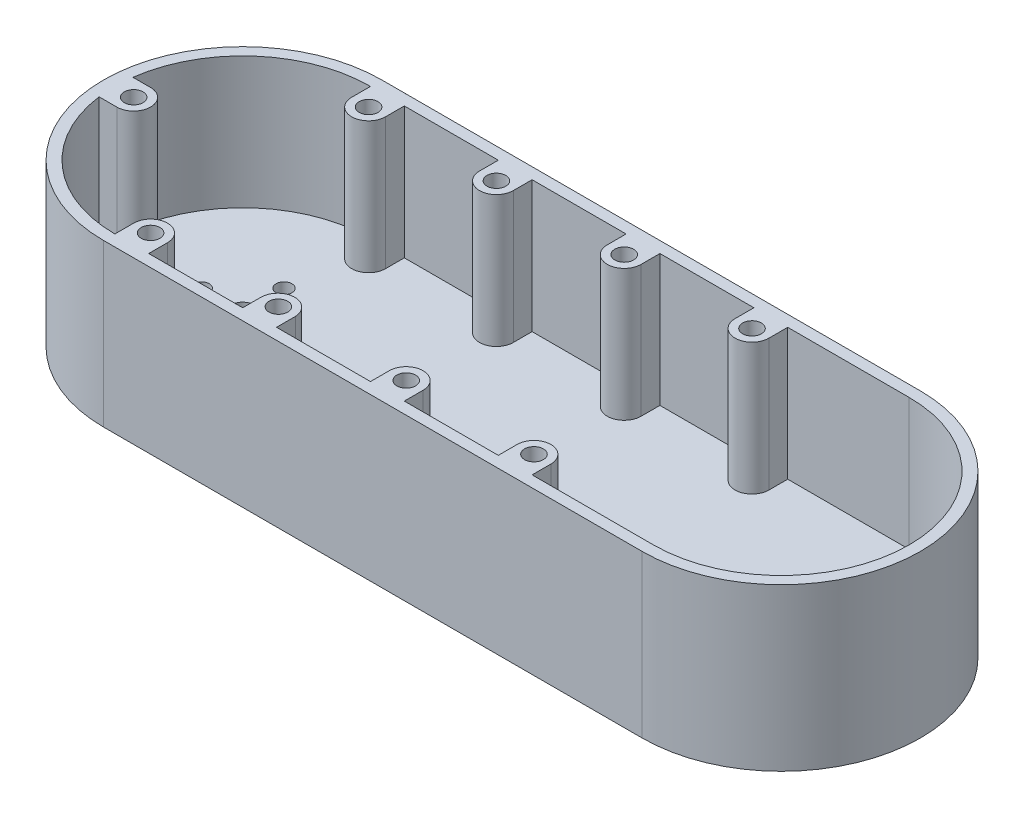
from build123d import *

# Parameters (mm, degrees)
SKETCH1_R           = 15
BOSS_EXTRUDE1_DEPTH = 5
BOSS_EXTRUDE2_DEPTH = 8
BOSS_EXTRUDE3_DEPTH = 35
SKETCH4_R           = 2.1
SKETCH4_R_2         = 3.25
CUT_EXTRUDE1_DEPTH  = 35
SKETCH5_R           = 2.5
BOSS_EXTRUDE4_DEPTH = 35


with BuildPart() as part:
    # Sketch1 → Boss-Extrude1 (new body)
    with BuildSketch(Plane(origin=(0, 0, 0), x_dir=(1, 0, 0), z_dir=(0, 1, 0))):
        with Locations(Location((0, 0, 0), (0, 0, 270))):
            Circle(SKETCH1_R)
    extrude(amount=BOSS_EXTRUDE1_DEPTH)

    # Sketch2 → Boss-Extrude2 (add)
    with BuildSketch(Plane(origin=(0, 5, 0), x_dir=(1, 0, 0), z_dir=(0, 1, 0))):
        with BuildLine():
            Line((0, -37), (143.3, -37))
            ThreePointArc((143.3, -37), (180.3, 0), (143.3, 37))
            Line((143.3, 37), (0, 37))
            ThreePointArc((0, 37), (-37, 0), (0, -37))
        make_face()
    extrude(amount=BOSS_EXTRUDE2_DEPTH)

    # Sketch3 → Boss-Extrude3 (add)
    with BuildSketch(Plane(origin=(0, 13, 0), x_dir=(1, 0, 0), z_dir=(0, 1, 0))):
        with BuildLine():
            Line((143.3, 37), (0, 37))
            ThreePointArc((0, 37), (-37, 0), (0, -37))
            Line((0, -37), (143.3, -37))
            ThreePointArc((143.3, -37), (180.3, 0), (143.3, 37))
        make_face()
        with BuildLine():
            ThreePointArc((0, 34), (-34, 0), (0, -34))
            Line((0, -34), (143.3, -34))
            ThreePointArc((143.3, -34), (177.3, 0), (143.3, 34))
            Line((143.3, 34), (0, 34))
        make_face(mode=Mode.SUBTRACT)
    extrude(amount=BOSS_EXTRUDE3_DEPTH)

    # Sketch4 → Cut-Extrude1 (cut)
    with BuildSketch(Plane(origin=(0, 13, 0), x_dir=(1, 0, 0), z_dir=(0, 1, 0))):
        with Locations(Location((-11, 0, 0), (0, 0, 270))):
            Circle(SKETCH4_R)
        with Locations(Location((0, 0, 0), (0, 0, 270))):
            Circle(SKETCH4_R_2)
        with Locations(Location((0, 10.995299238, 0), (0, 0, 270))):
            Circle(SKETCH4_R)
        with Locations(Location((11, 0, 0), (0, 0, 270))):
            Circle(SKETCH4_R)
        with Locations(Location((0, -11, 0), (0, 0, 270))):
            Circle(SKETCH4_R)
    extrude(amount=-CUT_EXTRUDE1_DEPTH, mode=Mode.SUBTRACT)

    # Sketch5 → Boss-Extrude4 (add)
    # profile 1 of 9: a face of its own
    with BuildSketch(Plane(origin=(0, 13, 0), x_dir=(1, 0, 0), z_dir=(0, 1, 0))):
        with BuildLine():
            Line((-29, 4.5), (-33.700890196, 4.5))
            ThreePointArc((-33.700890196, 4.5), (-34, 0), (-33.700890196, -4.5))
            Line((-33.700890196, -4.5), (-29, -4.5))
            ThreePointArc((-29, -4.5), (-24.5, 0), (-29, 4.5))
        make_face()
        with Locations(Location((-29, 0, 0), (0, 0, 270))):
            Circle(SKETCH5_R, mode=Mode.SUBTRACT)
    # profile 2 of 9: a face of its own
    with BuildSketch(Plane(origin=(0, 13, 0), x_dir=(1, 0, 0), z_dir=(0, 1, 0))):
        with BuildLine():
            Line((9, 34), (0, 34))
            Line((0, 34), (0, 29))
            ThreePointArc((0, 29), (4.5, 24.5), (9, 29))
            Line((9, 29), (9, 34))
        make_face()
        with Locations(Location((4.5, 29, 0), (0, 0, 270))):
            Circle(SKETCH5_R, mode=Mode.SUBTRACT)
    # profile 3 of 9: a face of its own
    with BuildSketch(Plane(origin=(0, 13, 0), x_dir=(1, 0, 0), z_dir=(0, 1, 0))):
        with BuildLine():
            Line((43, 34), (34, 34))
            Line((34, 34), (34, 29))
            ThreePointArc((34, 29), (38.5, 24.5), (43, 29))
            Line((43, 29), (43, 34))
        make_face()
        with Locations(Location((38.5, 29, 0), (0, 0, 270))):
            Circle(SKETCH5_R, mode=Mode.SUBTRACT)
    # profile 4 of 9: a face of its own
    with BuildSketch(Plane(origin=(0, 13, 0), x_dir=(1, 0, 0), z_dir=(0, 1, 0))):
        with BuildLine():
            Line((77, 34), (68, 34))
            Line((68, 34), (68, 29))
            ThreePointArc((68, 29), (72.5, 24.5), (77, 29))
            Line((77, 29), (77, 34))
        make_face()
        with Locations(Location((72.5, 29, 0), (0, 0, 270))):
            Circle(SKETCH5_R, mode=Mode.SUBTRACT)
    # profile 5 of 9: a face of its own
    with BuildSketch(Plane(origin=(0, 13, 0), x_dir=(1, 0, 0), z_dir=(0, 1, 0))):
        with BuildLine():
            Line((68, -29), (68, -34))
            Line((68, -34), (77, -34))
            Line((77, -34), (77, -29))
            ThreePointArc((77, -29), (72.5, -24.5), (68, -29))
        make_face()
        with Locations(Location((72.5, -29, 0), (0, 0, 270))):
            Circle(SKETCH5_R, mode=Mode.SUBTRACT)
    # profile 6 of 9: a face of its own
    with BuildSketch(Plane(origin=(0, 13, 0), x_dir=(1, 0, 0), z_dir=(0, 1, 0))):
        with BuildLine():
            Line((34, -29), (34, -34))
            Line((34, -34), (43, -34))
            Line((43, -34), (43, -29))
            ThreePointArc((43, -29), (38.5, -24.653460046), (34, -29))
        make_face()
        with Locations(Location((38.5, -29, 0), (0, 0, 270))):
            Circle(SKETCH5_R, mode=Mode.SUBTRACT)
    # profile 7 of 9: a face of its own
    with BuildSketch(Plane(origin=(0, 13, 0), x_dir=(1, 0, 0), z_dir=(0, 1, 0))):
        with BuildLine():
            Line((0, -29), (0, -34))
            Line((0, -34), (9, -34))
            Line((9, -34), (9, -29))
            ThreePointArc((9, -29), (4.5, -24.5), (0, -29))
        make_face()
        with Locations(Location((4.5, -29, 0), (0, 0, 270))):
            Circle(SKETCH5_R, mode=Mode.SUBTRACT)
    # profile 8 of 9: a face of its own
    with BuildSketch(Plane(origin=(0, 13, 0), x_dir=(1, 0, 0), z_dir=(0, 1, 0))):
        with BuildLine():
            Line((111, 34), (102, 34))
            Line((102, 34), (102, 29))
            ThreePointArc((102, 29), (106.5, 24.5), (111, 29))
            Line((111, 29), (111, 34))
        make_face()
        with Locations(Location((106.5, 29, 0), (0, 0, 270))):
            Circle(SKETCH5_R, mode=Mode.SUBTRACT)
    # profile 9 of 9: a face of its own
    with BuildSketch(Plane(origin=(0, 13, 0), x_dir=(1, 0, 0), z_dir=(0, 1, 0))):
        with BuildLine():
            Line((102, -29), (102, -34))
            Line((102, -34), (111, -34))
            Line((111, -34), (111, -29))
            ThreePointArc((111, -29), (106.5, -24.5), (102, -29))
        make_face()
        with Locations(Location((106.5, -29, 0), (0, 0, 270))):
            Circle(SKETCH5_R, mode=Mode.SUBTRACT)
    extrude(amount=BOSS_EXTRUDE4_DEPTH)


solid = part.part
